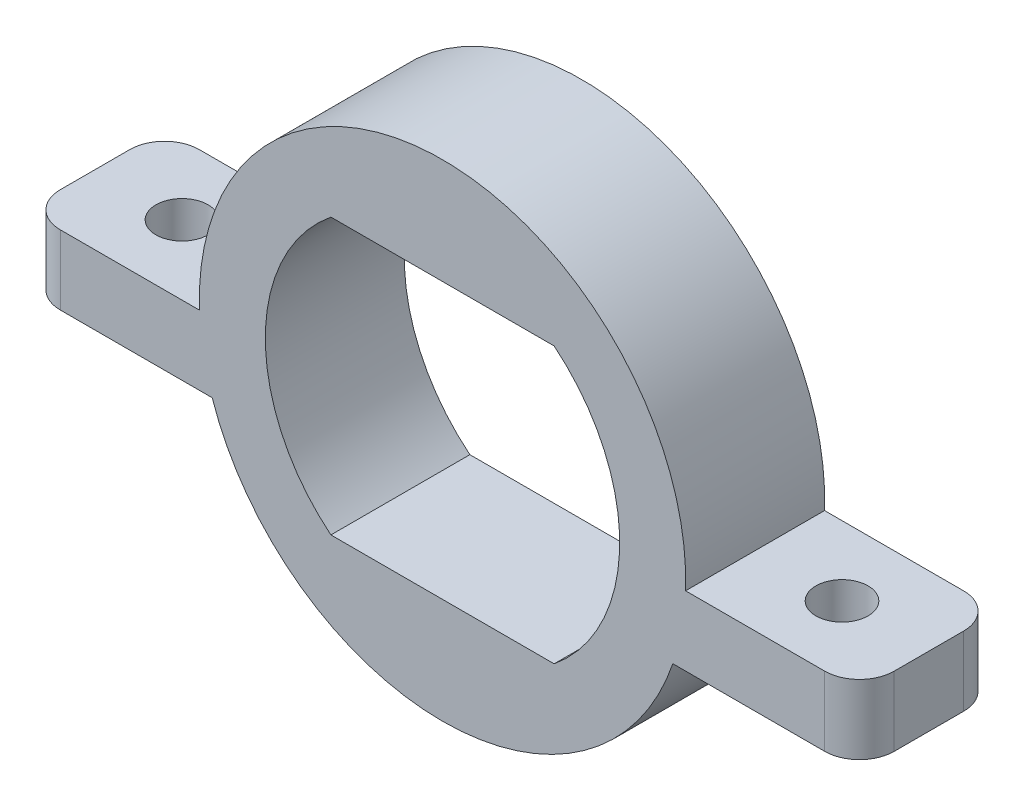
from build123d import *

# Parameters (mm, degrees)
SALIENTE_EXTRUIR1_DEPTH = 8
CORTAR_EXTRUIR1_DEPTH   = 29.91366459
CROQUIS3_R              = 1.5
CORTAR_EXTRUIR2_DEPTH   = 5
REDONDEO1_R             = 2


with BuildPart() as part:
    # Croquis1 → Saliente-Extruir1 (new body)
    with BuildSketch(Plane.XY):
        with BuildLine():
            Line((-24, -0.5), (-13.99106858, -0.5))
            ThreePointArc((-13.99106858, -0.5), (0, 14), (13.99106858, -0.5))
            Line((13.99106858, -0.5), (24, -0.5))
            Line((24, -0.5), (24, -4.5))
            Line((24, -4.5), (13.257073584, -4.5))
            ThreePointArc((13.257073584, -4.5), (0, -14), (-13.257073584, -4.5))
            Line((-13.257073584, -4.5), (-24, -4.5))
            Line((-24, -4.5), (-24, -0.5))
        make_face()
    extrude(amount=SALIENTE_EXTRUIR1_DEPTH)

    # Croquis2 → Cortar-Extruir1 (cut, through all)
    with BuildSketch(Plane.XY.offset(8)):
        with BuildLine():
            Line((-6.425, 7.922081482), (6.425, 7.922081482))
            ThreePointArc((6.425, 7.922081482), (10.2, 0), (6.425, -7.922081482))
            Line((6.425, -7.922081482), (-6.425, -7.922081482))
            ThreePointArc((-6.425, -7.922081482), (-10.2, 0), (-6.425, 7.922081482))
        make_face()
    extrude(amount=-CORTAR_EXTRUIR1_DEPTH, mode=Mode.SUBTRACT)

    # Croquis3 → Cortar-Extruir2 (cut)
    with BuildSketch(Plane(origin=(0, -0.5, 0), x_dir=(1, 0, 0), z_dir=(0, 1, 0))):
        with Locations(Location((18.99553429, -4, 0), (0, 0, 270))):
            Circle(CROQUIS3_R)
        with Locations(Location((-18.99553429, -4, 0), (0, 0, 270))):
            Circle(CROQUIS3_R)
    extrude(amount=-CORTAR_EXTRUIR2_DEPTH, mode=Mode.SUBTRACT)

    # Redondeo1
    redondeo1_edges = [part.edges().sort_by_distance(p)[0] for p in [
        (-24, -2.5, 8),
        (24, -2.5, 8),
        (24, -2.5, 0),
        (-24, -2.5, 0),
    ]]
    fillet(redondeo1_edges, radius=REDONDEO1_R)


solid = part.part
